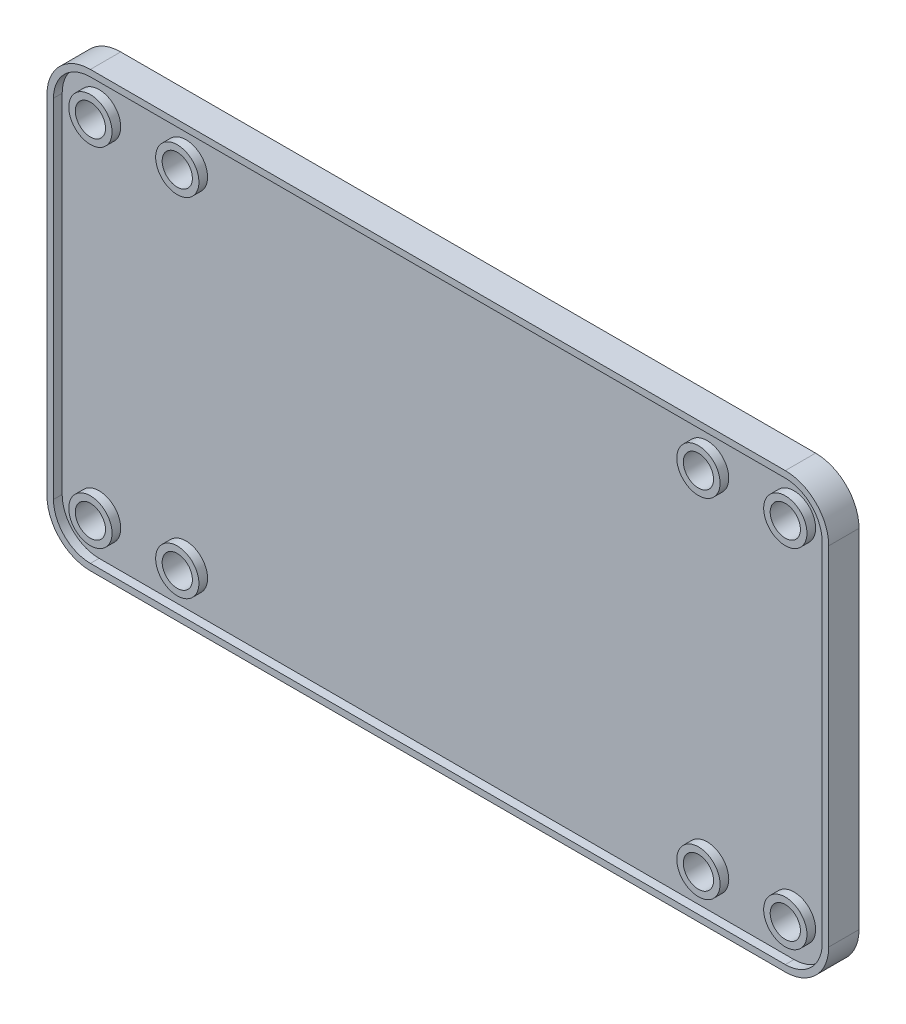
from build123d import *

# Parameters (mm, degrees)
SKETCH1_R           = 2.2098
BOSS_EXTRUDE1_DEPTH = 3.175
SKETCH2_R           = 3.1623
CUT_EXTRUDE3_DEPTH  = 1.27
SKETCH3_R           = 2.2098
BOSS_EXTRUDE2_DEPTH = 1.253000034


with BuildPart() as part:
    # Sketch1 → Boss-Extrude1 (new body)
    with BuildSketch(Plane.XY):
        with BuildLine():
            Line((-50.8, -31.75), (50.8, -31.75))
            ThreePointArc((50.8, -31.75), (55.290128061, -29.890128061), (57.15, -25.4))
            Line((57.15, -25.4), (57.15, 25.4))
            ThreePointArc((57.15, 25.4), (55.290128061, 29.890128061), (50.8, 31.75))
            Line((50.8, 31.75), (-50.8, 31.75))
            ThreePointArc((-50.8, 31.75), (-55.290128061, 29.890128061), (-57.15, 25.4))
            Line((-57.15, 25.4), (-57.15, -25.4))
            ThreePointArc((-57.15, -25.4), (-55.290128061, -29.890128061), (-50.8, -31.75))
        make_face()
        with Locations((-50.8, -25.4)):
            Circle(SKETCH1_R, mode=Mode.SUBTRACT)
        with Locations((-38.1, -25.4)):
            Circle(SKETCH1_R, mode=Mode.SUBTRACT)
        with Locations(Location((-50.8, 25.4, 0), (0, 0, 180))):
            Circle(SKETCH1_R, mode=Mode.SUBTRACT)
        with Locations(Location((-38.1, 25.4, 0), (0, 0, 180))):
            Circle(SKETCH1_R, mode=Mode.SUBTRACT)
        with Locations((50.8, 25.4)):
            Circle(SKETCH1_R, mode=Mode.SUBTRACT)
        with Locations((38.1, 25.4)):
            Circle(SKETCH1_R, mode=Mode.SUBTRACT)
        with Locations(Location((50.8, -25.4, 0), (0, 0, 180))):
            Circle(SKETCH1_R, mode=Mode.SUBTRACT)
        with Locations(Location((38.1, -25.4, 0), (0, 0, 180))):
            Circle(SKETCH1_R, mode=Mode.SUBTRACT)
    extrude(amount=-BOSS_EXTRUDE1_DEPTH)

    # Sketch2 → Cut-Extrude3 (cut)
    with BuildSketch(Plane.XY):
        with BuildLine():
            Line((50.8, 30.7975), (-50.8, 30.7975))
            ThreePointArc((-50.8, 30.7975), (-54.616608851, 29.216608851), (-56.1975, 25.4))
            Line((-56.1975, 25.4), (-56.1975, -25.4))
            ThreePointArc((-56.1975, -25.4), (-54.616608851, -29.216608851), (-50.8, -30.7975))
            Line((-50.8, -30.7975), (50.8, -30.7975))
            ThreePointArc((50.8, -30.7975), (54.616608851, -29.216608851), (56.1975, -25.4))
            Line((56.1975, -25.4), (56.1975, 25.4))
            ThreePointArc((56.1975, 25.4), (54.616608851, 29.216608851), (50.8, 30.7975))
        make_face()
        with Locations((38.1, 25.4)):
            Circle(SKETCH2_R, mode=Mode.SUBTRACT)
        with Locations((50.8, 25.4)):
            Circle(SKETCH2_R, mode=Mode.SUBTRACT)
        with Locations((50.8, -25.4)):
            Circle(SKETCH2_R, mode=Mode.SUBTRACT)
        with Locations((38.1, -25.4)):
            Circle(SKETCH2_R, mode=Mode.SUBTRACT)
        with Locations((-38.1, -25.4)):
            Circle(SKETCH2_R, mode=Mode.SUBTRACT)
        with Locations((-50.8, -25.4)):
            Circle(SKETCH2_R, mode=Mode.SUBTRACT)
        with Locations((-38.1, 25.4)):
            Circle(SKETCH2_R, mode=Mode.SUBTRACT)
        with Locations((-50.8, 25.4)):
            Circle(SKETCH2_R, mode=Mode.SUBTRACT)
    extrude(amount=-CUT_EXTRUDE3_DEPTH, mode=Mode.SUBTRACT)

    # Sketch3 → Boss-Extrude2 (add)
    with BuildSketch(Plane(origin=(0, 0, -3.175), x_dir=(-1, 0, 0), z_dir=(0, 0, -1))):
        with BuildLine():
            Line((-57.15, 25.4), (-57.15, -25.4))
            ThreePointArc((-57.15, -25.4), (-55.290128061, -29.890128061), (-50.8, -31.75))
            Line((-50.8, -31.75), (50.8, -31.75))
            ThreePointArc((50.8, -31.75), (55.290128061, -29.890128061), (57.15, -25.4))
            Line((57.15, -25.4), (57.15, 25.4))
            ThreePointArc((57.15, 25.4), (55.290128061, 29.890128061), (50.8, 31.75))
            Line((50.8, 31.75), (-50.8, 31.75))
            ThreePointArc((-50.8, 31.75), (-55.290128061, 29.890128061), (-57.15, 25.4))
        make_face()
        with Locations((-50.8, -25.4)):
            Circle(SKETCH3_R, mode=Mode.SUBTRACT)
        with Locations((-38.1, -25.4)):
            Circle(SKETCH3_R, mode=Mode.SUBTRACT)
        with Locations(Location((38.1, -25.4, 0), (0, 0, 180))):
            Circle(SKETCH3_R, mode=Mode.SUBTRACT)
        with Locations(Location((50.8, -25.4, 0), (0, 0, 180))):
            Circle(SKETCH3_R, mode=Mode.SUBTRACT)
        with Locations((50.8, 25.4)):
            Circle(SKETCH3_R, mode=Mode.SUBTRACT)
        with Locations((38.1, 25.4)):
            Circle(SKETCH3_R, mode=Mode.SUBTRACT)
        with Locations(Location((-38.1, 25.4, 0), (0, 0, 180))):
            Circle(SKETCH3_R, mode=Mode.SUBTRACT)
        with Locations(Location((-50.8, 25.4, 0), (0, 0, 180))):
            Circle(SKETCH3_R, mode=Mode.SUBTRACT)
    extrude(amount=BOSS_EXTRUDE2_DEPTH)


solid = part.part
